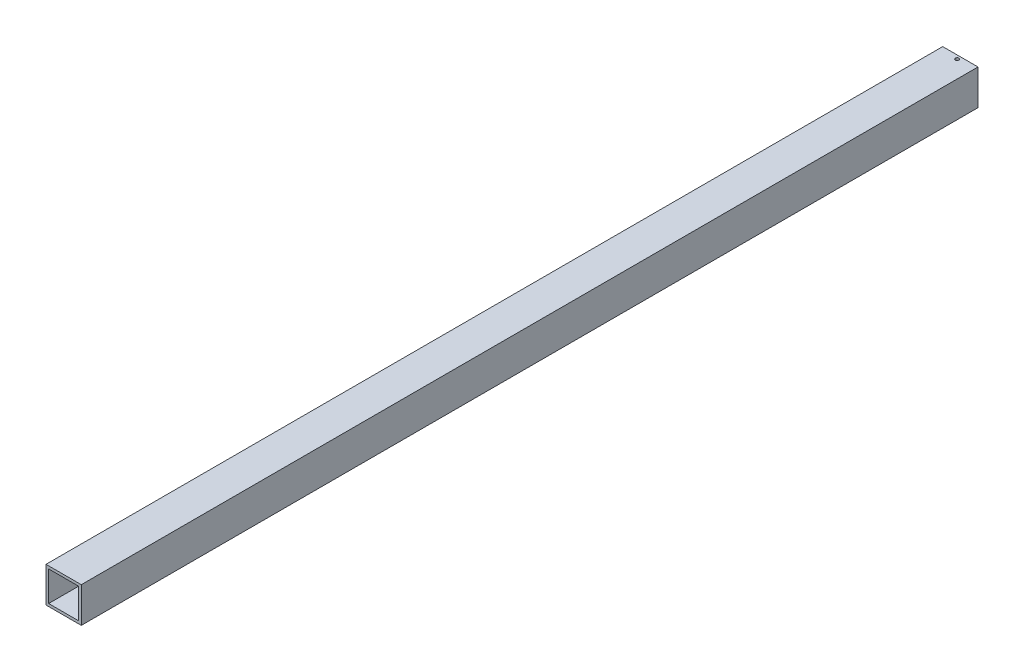
from build123d import *

# Parameters (mm, degrees)
SZKIC1_W                    = 20
SZKIC1_H                    = 20
SZKIC1_W_2                  = 17
SZKIC1_H_2                  = 17
DODANIE_WYCI_GNI_CIE1_DEPTH = 508.315366476
SZKIC3_R                    = 1
WYTNIJ_WYCI_GNI_CIE1_DEPTH  = 510.617572349


with BuildPart() as part:
    # Szkic1 → Dodanie-wyciągnięcie1 (new body)
    with BuildSketch(Plane.XY):
        with Locations((-20.422988866, 8.5)):
            Rectangle(SZKIC1_W, SZKIC1_H)
        with Locations((-20.422988866, 8.5)):
            Rectangle(SZKIC1_W_2, SZKIC1_H_2, mode=Mode.SUBTRACT)
    extrude(amount=DODANIE_WYCI_GNI_CIE1_DEPTH)

    # Szkic3 → Wytnij-wyciągnięcie1 (cut, through all)
    with BuildSketch(Plane(origin=(0, 18.5, 0), x_dir=(1, 0, 0), z_dir=(0, 1, 0))):
        with Locations(Location((-20.171616984, -2.046389983, 0), (0, 0, 180))):
            Circle(SZKIC3_R)
    extrude(amount=-WYTNIJ_WYCI_GNI_CIE1_DEPTH, mode=Mode.SUBTRACT)


solid = part.part
